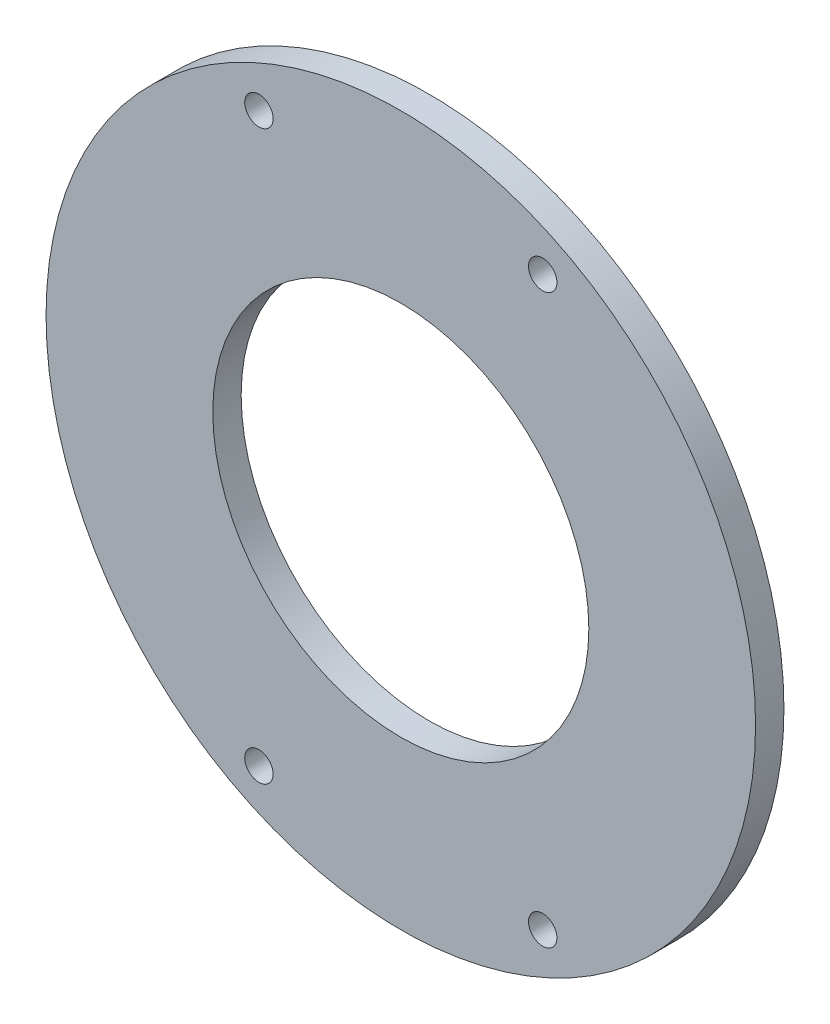
from build123d import *

# Parameters (mm, degrees)
SKETCH_1_R      = 50
SKETCH_1_R_2    = 2
SKETCH_1_R_3    = 26.5
EXTRUDE_1_DEPTH = 4


with BuildPart() as part:
    # 草图1 → 凸台-拉伸1 (new body)
    with BuildSketch(Plane.XY):
        with Locations((0, -21.854285714)):
            Circle(SKETCH_1_R)
        with Locations((-20, 18.145714286)):
            Circle(SKETCH_1_R_2, mode=Mode.SUBTRACT)
        with Locations((20, 18.145714286)):
            Circle(SKETCH_1_R_2, mode=Mode.SUBTRACT)
        with Locations(Location((20, -61.854285714, 0), (0, 0, 180))):
            Circle(SKETCH_1_R_2, mode=Mode.SUBTRACT)
        with Locations(Location((-20, -61.854285714, 0), (0, 0, 180))):
            Circle(SKETCH_1_R_2, mode=Mode.SUBTRACT)
        with Locations((0, -21.854285714)):
            Circle(SKETCH_1_R_3, mode=Mode.SUBTRACT)
    extrude(amount=EXTRUDE_1_DEPTH)


solid = part.part
